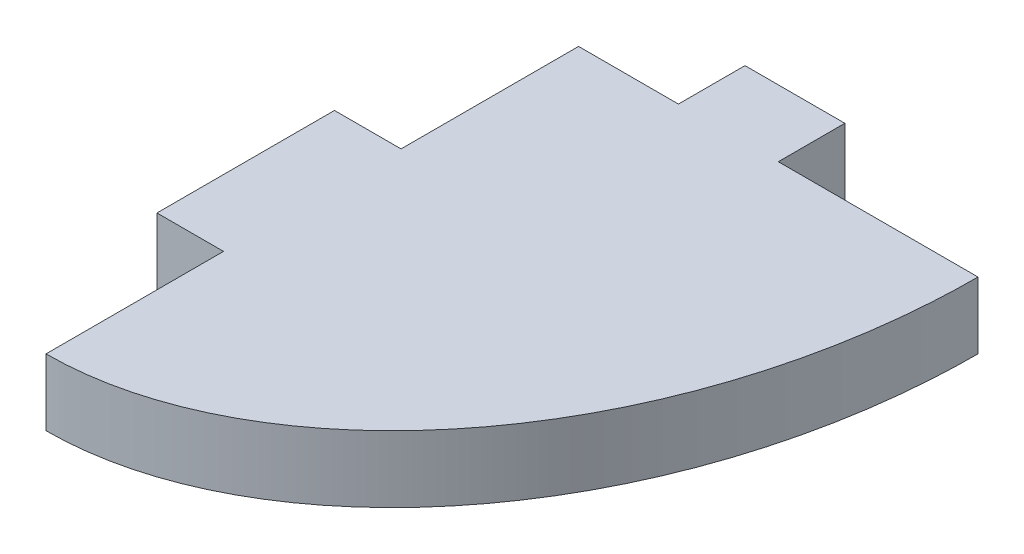
from build123d import *

# Parameters (mm, degrees)
BOSS_EXTRUDE1_DEPTH = 6.35


with BuildPart() as part:
    # Sketch1 → Boss-Extrude1 (new body)
    with BuildSketch(Plane(origin=(0, 0, 0), x_dir=(1, 0, 0), z_dir=(0, 1, 0))):
        with BuildLine():
            Line((0, 0), (0, 16.933333418))
            Line((0, 16.933333418), (-6.35, 16.933333418))
            Line((-6.35, 16.933333418), (-6.35, 33.866666751))
            Line((-6.35, 33.866666751), (0, 33.866666751))
            Line((0, 33.866666751), (0, 50.800000085))
            Line((0, 50.800000085), (9.525, 50.800000085))
            Line((9.525, 50.800000085), (9.525, 57.150000085))
            Line((9.525, 57.150000085), (19.05, 57.150000085))
            Line((19.05, 57.150000085), (19.05, 50.800000085))
            Line((19.05, 50.800000085), (38.1, 50.800000085))
            add(Edge.make_bspline(
                [(0, 0), (38.1, 0), (38.1, 50.800000085)],
                knots=[3.141592654, 3.141592654, 3.141592654, 4.71238898, 4.71238898, 4.71238898], degree=2, weights=[1, 0.707106781, 1]))
        make_face()
    extrude(amount=BOSS_EXTRUDE1_DEPTH)


solid = part.part
